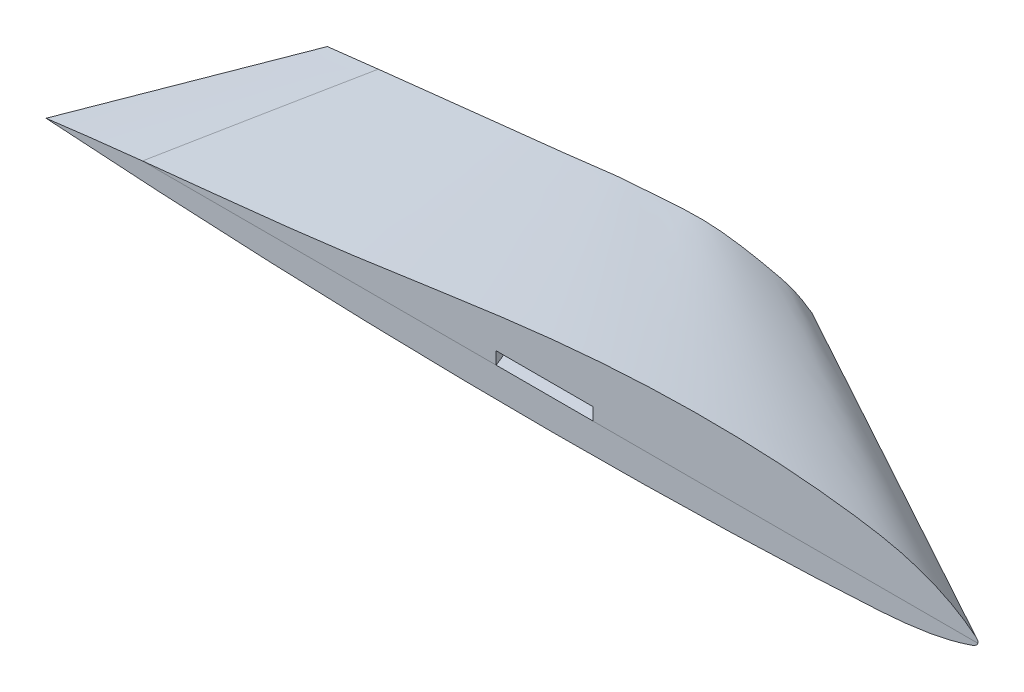
from build123d import *

# Parameters (mm, degrees)
FILLET1_R          = 6.35
CUT_EXTRUDE1_DEPTH = 5.715


with BuildPart() as part:
    # Sketch1 → Loft1 section 0
    with BuildSketch(Plane.XY):
        with BuildLine():
            add(Edge.make_bspline(
                [(-353.097115344, 3.76640622), (-263.60988857, 15.489732087), (-103.405625954, 27.702523148), (139.625383809, 69.731889132), (320.600909148, 70.897971745), (447.029350736, 49.156772515), (484.461992977, 32.39779841), (505.225432444, 13.29140622)],
                knots=[0, 0, 0, 0, 0.308401543, 0.542913332, 0.850169973, 0.887176211, 1, 1, 1, 1], degree=3))
            add(Edge.make_bspline(
                [(-353.097115344, 3.76640622), (-171.204173065, -8.622681299), (70.681231732, -17.726989966), (367.634485174, -8.589262826), (467.934967897, -1.634661846), (505.225432444, 13.29140622)],
                knots=[0, 0, 0, 0, 0.625313044, 0.861778666, 1, 1, 1, 1], degree=3))
        make_face()
    # Sketch2 → Loft1 section 1
    with BuildSketch(Plane.XY.offset(-180.975)):
        with BuildLine():
            add(Edge.make_bspline(
                [(-276.130119323, 8.693130358), (-231.459725957, 13.892182525), (-160.606907467, 22.045765928), (-55.21857633, 32.848239562), (-5.484684229, 39.5878223), (20.294760191, 40.734135472), (52.215253795, 43.311195196), (77.433370096, 43.854837121), (107.657853328, 39.590984865), (131.131357877, 34.766526999), (149.499224412, 30.294140301), (163.418705178, 23.059137739), (171.530279946, 16.921852673), (175.269753602, 13.29140622)],
                knots=[0, 0, 0, 0, 0.247403676, 0.462108507, 0.504395118, 0.627983171, 0.653401948, 0.743134379, 0.818760812, 0.882434425, 0.924179622, 0.96050512, 1, 1, 1, 1], degree=3))
            add(Edge.make_bspline(
                [(-276.130119323, 8.693130358), (-174.260953063, 0.911239157), (-23.669401798, 0.683864032), (127.515095646, 0.681371654), (175.269753602, 13.29140622)],
                knots=[0, 0, 0, 0, 0.67646369, 1, 1, 1, 1], degree=3))
        make_face()
    loft()

    # Fillet1
    fillet1_edges = [part.edges().sort_by_distance(p)[0] for p in [
        (340.247593023, 13.29140622, -90.4875),
    ]]
    fillet(fillet1_edges, radius=FILLET1_R)

    # Sketch7 → Cut-Extrude1 (cut, symmetric)
    with BuildSketch(Plane(origin=(0, 19.812, 0), x_dir=(1, 0, 0), z_dir=(0, 1, 0))):
        Polygon((148.552884656, 0), (75.434238435, 180.975), (-13.465761565, 180.975), (59.652884656, 0), align=None)
    extrude(amount=CUT_EXTRUDE1_DEPTH, both=True, mode=Mode.SUBTRACT)


with BuildPart() as body_2:
    # Split1: the piece on the far side of the plane
    add(part.part)
    split(bisect_by=Plane.ZX.offset(14.097), keep=Keep.BOTTOM)


with BuildPart() as part_1:
    add(part.part)

    # Split1
    split(bisect_by=Plane.ZX.offset(14.097), keep=Keep.TOP)


solid = Compound([body_2.part, part_1.part])
